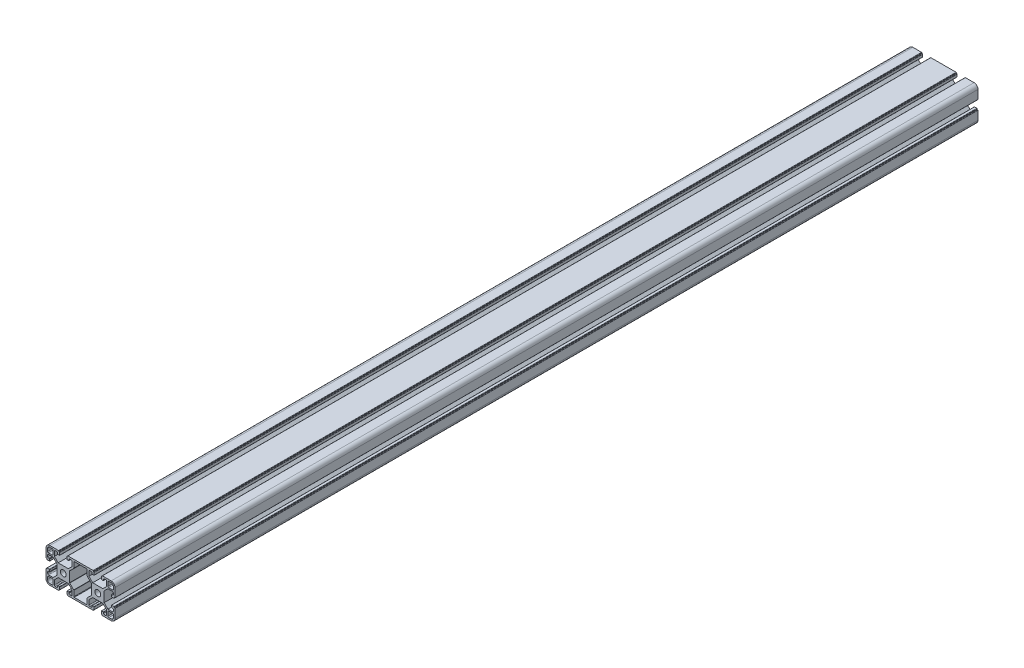
from build123d import *

# Parameters (mm, degrees)
MODEL_R             = 3.4
BOSS_EXTRUDE1_DEPTH = 1000


with BuildPart() as part:
    # Model → Boss-Extrude1 (new body)
    with BuildSketch(Plane.XY):
        with BuildLine():
            Line((3107.864182272, 1445.852361123), (3108.864182272, 1445.852361123))
            ThreePointArc((3108.864182272, 1445.852361123), (3109.076314306, 1445.940229088), (3109.164182272, 1446.152361123))
            Line((3109.164182272, 1446.152361123), (3109.164182272, 1448.052361123))
            ThreePointArc((3109.164182272, 1448.052361123), (3109.076314306, 1448.264493157), (3108.864182272, 1448.352361123))
            Line((3108.864182272, 1448.352361123), (3106.164182272, 1448.352361123))
            ThreePointArc((3106.164182272, 1448.352361123), (3105.952050238, 1448.264493157), (3105.864182272, 1448.052361123))
            Line((3105.864182272, 1448.052361123), (3105.864182272, 1447.552361123))
            ThreePointArc((3105.864182272, 1447.552361123), (3105.805603628, 1447.410939767), (3105.664182272, 1447.352361123))
            Line((3105.664182272, 1447.352361123), (3105.164182272, 1447.352361123))
            ThreePointArc((3105.164182272, 1447.352361123), (3104.952050238, 1447.264493157), (3104.864182272, 1447.052361123))
            Line((3104.864182272, 1447.052361123), (3104.864182272, 1436.952361123))
            ThreePointArc((3104.864182272, 1436.952361123), (3106.182201757, 1433.770380607), (3109.364182272, 1432.452361123))
            Line((3109.364182272, 1432.452361123), (3119.464182272, 1432.452361123))
            ThreePointArc((3119.464182272, 1432.452361123), (3119.676314306, 1432.540229088), (3119.764182272, 1432.752361123))
            Line((3119.764182272, 1432.752361123), (3119.764182272, 1433.252361123))
            ThreePointArc((3119.764182272, 1433.252361123), (3119.822760916, 1433.393782479), (3119.964182272, 1433.452361123))
            Line((3119.964182272, 1433.452361123), (3120.464182272, 1433.452361123))
            ThreePointArc((3120.464182272, 1433.452361123), (3120.676314306, 1433.540229088), (3120.764182272, 1433.752361123))
            Line((3120.764182272, 1433.752361123), (3120.764182272, 1436.452361123))
            ThreePointArc((3120.764182272, 1436.452361123), (3120.676314306, 1436.664493157), (3120.464182272, 1436.752361123))
            Line((3120.464182272, 1436.752361123), (3118.564182272, 1436.752361123))
            ThreePointArc((3118.564182272, 1436.752361123), (3118.352050238, 1436.664493157), (3118.264182272, 1436.452361123))
            Line((3118.264182272, 1436.452361123), (3118.264182272, 1435.452361123))
            ThreePointArc((3118.264182272, 1435.452361123), (3117.971289053, 1434.745254342), (3117.264182272, 1434.452361123))
            Line((3117.264182272, 1434.452361123), (3115.614182272, 1434.452361123))
            ThreePointArc((3115.614182272, 1434.452361123), (3114.907075491, 1434.745254342), (3114.614182272, 1435.452361123))
            Line((3114.614182272, 1435.452361123), (3114.614182272, 1440.717436882))
            Line((3114.614182272, 1440.717436882), (3118.949106512, 1445.052361123))
            Line((3118.949106512, 1445.052361123), (3130.779258031, 1445.052361123))
            Line((3130.779258031, 1445.052361123), (3135.114182272, 1440.717436882))
            Line((3135.114182272, 1440.717436882), (3135.114182272, 1435.452361123))
            ThreePointArc((3135.114182272, 1435.452361123), (3134.821289053, 1434.745254342), (3134.114182272, 1434.452361123))
            Line((3134.114182272, 1434.452361123), (3132.464182272, 1434.452361123))
            ThreePointArc((3132.464182272, 1434.452361123), (3131.757075491, 1434.745254342), (3131.464182272, 1435.452361123))
            Line((3131.464182272, 1435.452361123), (3131.464182272, 1436.452361123))
            ThreePointArc((3131.464182272, 1436.452361123), (3131.376314306, 1436.664493157), (3131.164182272, 1436.752361123))
            Line((3131.164182272, 1436.752361123), (3129.264182272, 1436.752361123))
            ThreePointArc((3129.264182272, 1436.752361123), (3129.052050238, 1436.664493157), (3128.964182272, 1436.452361123))
            Line((3128.964182272, 1436.452361123), (3128.964182272, 1433.752361123))
            ThreePointArc((3128.964182272, 1433.752361123), (3129.052050238, 1433.540229088), (3129.264182272, 1433.452361123))
            Line((3129.264182272, 1433.452361123), (3129.764182272, 1433.452361123))
            ThreePointArc((3129.764182272, 1433.452361123), (3129.905603628, 1433.393782479), (3129.964182272, 1433.252361123))
            Line((3129.964182272, 1433.252361123), (3129.964182272, 1432.752361123))
            ThreePointArc((3129.964182272, 1432.752361123), (3130.052050238, 1432.540229088), (3130.264182272, 1432.452361123))
            Line((3130.264182272, 1432.452361123), (3159.464182272, 1432.452361123))
            ThreePointArc((3159.464182272, 1432.452361123), (3159.676314306, 1432.540229088), (3159.764182272, 1432.752361123))
            Line((3159.764182272, 1432.752361123), (3159.764182272, 1433.252361123))
            ThreePointArc((3159.764182272, 1433.252361123), (3159.822760916, 1433.393782479), (3159.964182272, 1433.452361123))
            Line((3159.964182272, 1433.452361123), (3160.464182272, 1433.452361123))
            ThreePointArc((3160.464182272, 1433.452361123), (3160.676314306, 1433.540229088), (3160.764182272, 1433.752361123))
            Line((3160.764182272, 1433.752361123), (3160.764182272, 1436.452361123))
            ThreePointArc((3160.764182272, 1436.452361123), (3160.676314306, 1436.664493157), (3160.464182272, 1436.752361123))
            Line((3160.464182272, 1436.752361123), (3158.564182272, 1436.752361123))
            ThreePointArc((3158.564182272, 1436.752361123), (3158.352050238, 1436.664493157), (3158.264182272, 1436.452361123))
            Line((3158.264182272, 1436.452361123), (3158.264182272, 1435.452361123))
            ThreePointArc((3158.264182272, 1435.452361123), (3157.971289053, 1434.745254342), (3157.264182272, 1434.452361123))
            Line((3157.264182272, 1434.452361123), (3155.614182272, 1434.452361123))
            ThreePointArc((3155.614182272, 1434.452361123), (3154.907075491, 1434.745254342), (3154.614182272, 1435.452361123))
            Line((3154.614182272, 1435.452361123), (3154.614182272, 1440.717436882))
            Line((3154.614182272, 1440.717436882), (3158.949106512, 1445.052361123))
            Line((3158.949106512, 1445.052361123), (3170.779258031, 1445.052361123))
            Line((3170.779258031, 1445.052361123), (3175.114182272, 1440.717436882))
            Line((3175.114182272, 1440.717436882), (3175.114182272, 1435.452361123))
            ThreePointArc((3175.114182272, 1435.452361123), (3174.821289053, 1434.745254342), (3174.114182272, 1434.452361123))
            Line((3174.114182272, 1434.452361123), (3172.464182272, 1434.452361123))
            ThreePointArc((3172.464182272, 1434.452361123), (3171.757075491, 1434.745254342), (3171.464182272, 1435.452361123))
            Line((3171.464182272, 1435.452361123), (3171.464182272, 1436.452361123))
            ThreePointArc((3171.464182272, 1436.452361123), (3171.376314306, 1436.664493157), (3171.164182272, 1436.752361123))
            Line((3171.164182272, 1436.752361123), (3169.264182272, 1436.752361123))
            ThreePointArc((3169.264182272, 1436.752361123), (3169.052050238, 1436.664493157), (3168.964182272, 1436.452361123))
            Line((3168.964182272, 1436.452361123), (3168.964182272, 1433.752361123))
            ThreePointArc((3168.964182272, 1433.752361123), (3169.052050238, 1433.540229088), (3169.264182272, 1433.452361123))
            Line((3169.264182272, 1433.452361123), (3169.764182272, 1433.452361123))
            ThreePointArc((3169.764182272, 1433.452361123), (3169.905603628, 1433.393782479), (3169.964182272, 1433.252361123))
            Line((3169.964182272, 1433.252361123), (3169.964182272, 1432.752361123))
            ThreePointArc((3169.964182272, 1432.752361123), (3170.052050238, 1432.540229088), (3170.264182272, 1432.452361123))
            Line((3170.264182272, 1432.452361123), (3180.364182272, 1432.452361123))
            ThreePointArc((3180.364182272, 1432.452361123), (3183.546162787, 1433.770380607), (3184.864182272, 1436.952361123))
            Line((3184.864182272, 1436.952361123), (3184.864182272, 1447.052361123))
            ThreePointArc((3184.864182272, 1447.052361123), (3184.776314306, 1447.264493157), (3184.564182272, 1447.352361123))
            Line((3184.564182272, 1447.352361123), (3184.064182272, 1447.352361123))
            ThreePointArc((3184.064182272, 1447.352361123), (3183.922760916, 1447.410939767), (3183.864182272, 1447.552361123))
            Line((3183.864182272, 1447.552361123), (3183.864182272, 1448.052361123))
            ThreePointArc((3183.864182272, 1448.052361123), (3183.776314306, 1448.264493157), (3183.564182272, 1448.352361123))
            Line((3183.564182272, 1448.352361123), (3180.864182272, 1448.352361123))
            ThreePointArc((3180.864182272, 1448.352361123), (3180.652050238, 1448.264493157), (3180.564182272, 1448.052361123))
            Line((3180.564182272, 1448.052361123), (3180.564182272, 1446.152361123))
            ThreePointArc((3180.564182272, 1446.152361123), (3180.652050238, 1445.940229088), (3180.864182272, 1445.852361123))
            Line((3180.864182272, 1445.852361123), (3181.864182272, 1445.852361123))
            ThreePointArc((3181.864182272, 1445.852361123), (3182.571289053, 1445.559467904), (3182.864182272, 1444.852361123))
            Line((3182.864182272, 1444.852361123), (3182.864182272, 1443.202361123))
            ThreePointArc((3182.864182272, 1443.202361123), (3182.571289053, 1442.495254342), (3181.864182272, 1442.202361123))
            Line((3181.864182272, 1442.202361123), (3176.599106512, 1442.202361123))
            Line((3176.599106512, 1442.202361123), (3172.264182272, 1446.537285363))
            Line((3172.264182272, 1446.537285363), (3172.264182272, 1458.367436882))
            Line((3172.264182272, 1458.367436882), (3176.599106512, 1462.702361123))
            Line((3176.599106512, 1462.702361123), (3181.864182272, 1462.702361123))
            ThreePointArc((3181.864182272, 1462.702361123), (3182.571289053, 1462.409467904), (3182.864182272, 1461.702361123))
            Line((3182.864182272, 1461.702361123), (3182.864182272, 1460.052361123))
            ThreePointArc((3182.864182272, 1460.052361123), (3182.571289053, 1459.345254342), (3181.864182272, 1459.052361123))
            Line((3181.864182272, 1459.052361123), (3180.864182272, 1459.052361123))
            ThreePointArc((3180.864182272, 1459.052361123), (3180.652050238, 1458.964493157), (3180.564182272, 1458.752361123))
            Line((3180.564182272, 1458.752361123), (3180.564182272, 1456.852361123))
            ThreePointArc((3180.564182272, 1456.852361123), (3180.652050238, 1456.640229088), (3180.864182272, 1456.552361123))
            Line((3180.864182272, 1456.552361123), (3183.564182272, 1456.552361123))
            ThreePointArc((3183.564182272, 1456.552361123), (3183.776314306, 1456.640229088), (3183.864182272, 1456.852361123))
            Line((3183.864182272, 1456.852361123), (3183.864182272, 1457.352361123))
            ThreePointArc((3183.864182272, 1457.352361123), (3183.922760916, 1457.493782479), (3184.064182272, 1457.552361123))
            Line((3184.064182272, 1457.552361123), (3184.564182272, 1457.552361123))
            ThreePointArc((3184.564182272, 1457.552361123), (3184.776314306, 1457.640229088), (3184.864182272, 1457.852361123))
            Line((3184.864182272, 1457.852361123), (3184.864182272, 1467.952361123))
            ThreePointArc((3184.864182272, 1467.952361123), (3183.546162787, 1471.134341638), (3180.364182272, 1472.452361123))
            Line((3180.364182272, 1472.452361123), (3170.264182272, 1472.452361123))
            ThreePointArc((3170.264182272, 1472.452361123), (3170.052050238, 1472.364493157), (3169.964182272, 1472.152361123))
            Line((3169.964182272, 1472.152361123), (3169.964182272, 1471.652361123))
            ThreePointArc((3169.964182272, 1471.652361123), (3169.905603628, 1471.510939767), (3169.764182272, 1471.452361123))
            Line((3169.764182272, 1471.452361123), (3169.264182272, 1471.452361123))
            ThreePointArc((3169.264182272, 1471.452361123), (3169.052050238, 1471.364493157), (3168.964182272, 1471.152361123))
            Line((3168.964182272, 1471.152361123), (3168.964182272, 1468.452361123))
            ThreePointArc((3168.964182272, 1468.452361123), (3169.052050238, 1468.240229088), (3169.264182272, 1468.152361123))
            Line((3169.264182272, 1468.152361123), (3171.164182272, 1468.152361123))
            ThreePointArc((3171.164182272, 1468.152361123), (3171.376314306, 1468.240229088), (3171.464182272, 1468.452361123))
            Line((3171.464182272, 1468.452361123), (3171.464182272, 1469.452361123))
            ThreePointArc((3171.464182272, 1469.452361123), (3171.757075491, 1470.159467904), (3172.464182272, 1470.452361123))
            Line((3172.464182272, 1470.452361123), (3174.114182272, 1470.452361123))
            ThreePointArc((3174.114182272, 1470.452361123), (3174.821289053, 1470.159467904), (3175.114182272, 1469.452361123))
            Line((3175.114182272, 1469.452361123), (3175.114182272, 1464.187285363))
            Line((3175.114182272, 1464.187285363), (3170.779258031, 1459.852361123))
            Line((3170.779258031, 1459.852361123), (3158.949106512, 1459.852361123))
            Line((3158.949106512, 1459.852361123), (3154.614182272, 1464.187285363))
            Line((3154.614182272, 1464.187285363), (3154.614182272, 1469.452361123))
            ThreePointArc((3154.614182272, 1469.452361123), (3154.907075491, 1470.159467904), (3155.614182272, 1470.452361123))
            Line((3155.614182272, 1470.452361123), (3157.264182272, 1470.452361123))
            ThreePointArc((3157.264182272, 1470.452361123), (3157.971289053, 1470.159467904), (3158.264182272, 1469.452361123))
            Line((3158.264182272, 1469.452361123), (3158.264182272, 1468.452361123))
            ThreePointArc((3158.264182272, 1468.452361123), (3158.352050238, 1468.240229088), (3158.564182272, 1468.152361123))
            Line((3158.564182272, 1468.152361123), (3160.464182272, 1468.152361123))
            ThreePointArc((3160.464182272, 1468.152361123), (3160.676314306, 1468.240229088), (3160.764182272, 1468.452361123))
            Line((3160.764182272, 1468.452361123), (3160.764182272, 1471.152361123))
            ThreePointArc((3160.764182272, 1471.152361123), (3160.676314306, 1471.364493157), (3160.464182272, 1471.452361123))
            Line((3160.464182272, 1471.452361123), (3159.964182272, 1471.452361123))
            ThreePointArc((3159.964182272, 1471.452361123), (3159.822760916, 1471.510939767), (3159.764182272, 1471.652361123))
            Line((3159.764182272, 1471.652361123), (3159.764182272, 1472.152361123))
            ThreePointArc((3159.764182272, 1472.152361123), (3159.676314306, 1472.364493157), (3159.464182272, 1472.452361123))
            Line((3159.464182272, 1472.452361123), (3130.264182272, 1472.452361123))
            ThreePointArc((3130.264182272, 1472.452361123), (3130.052050238, 1472.364493157), (3129.964182272, 1472.152361123))
            Line((3129.964182272, 1472.152361123), (3129.964182272, 1471.652361123))
            ThreePointArc((3129.964182272, 1471.652361123), (3129.905603628, 1471.510939767), (3129.764182272, 1471.452361123))
            Line((3129.764182272, 1471.452361123), (3129.264182272, 1471.452361123))
            ThreePointArc((3129.264182272, 1471.452361123), (3129.052050238, 1471.364493157), (3128.964182272, 1471.152361123))
            Line((3128.964182272, 1471.152361123), (3128.964182272, 1468.452361123))
            ThreePointArc((3128.964182272, 1468.452361123), (3129.052050238, 1468.240229088), (3129.264182272, 1468.152361123))
            Line((3129.264182272, 1468.152361123), (3131.164182272, 1468.152361123))
            ThreePointArc((3131.164182272, 1468.152361123), (3131.376314306, 1468.240229088), (3131.464182272, 1468.452361123))
            Line((3131.464182272, 1468.452361123), (3131.464182272, 1469.452361123))
            ThreePointArc((3131.464182272, 1469.452361123), (3131.757075491, 1470.159467904), (3132.464182272, 1470.452361123))
            Line((3132.464182272, 1470.452361123), (3134.114182272, 1470.452361123))
            ThreePointArc((3134.114182272, 1470.452361123), (3134.821289053, 1470.159467904), (3135.114182272, 1469.452361123))
            Line((3135.114182272, 1469.452361123), (3135.114182272, 1464.187285363))
            Line((3135.114182272, 1464.187285363), (3130.779258031, 1459.852361123))
            Line((3130.779258031, 1459.852361123), (3118.949106512, 1459.852361123))
            Line((3118.949106512, 1459.852361123), (3114.614182272, 1464.187285363))
            Line((3114.614182272, 1464.187285363), (3114.614182272, 1469.452361123))
            ThreePointArc((3114.614182272, 1469.452361123), (3114.907075491, 1470.159467904), (3115.614182272, 1470.452361123))
            Line((3115.614182272, 1470.452361123), (3117.264182272, 1470.452361123))
            ThreePointArc((3117.264182272, 1470.452361123), (3117.971289053, 1470.159467904), (3118.264182272, 1469.452361123))
            Line((3118.264182272, 1469.452361123), (3118.264182272, 1468.452361123))
            ThreePointArc((3118.264182272, 1468.452361123), (3118.352050238, 1468.240229088), (3118.564182272, 1468.152361123))
            Line((3118.564182272, 1468.152361123), (3120.464182272, 1468.152361123))
            ThreePointArc((3120.464182272, 1468.152361123), (3120.676314306, 1468.240229088), (3120.764182272, 1468.452361123))
            Line((3120.764182272, 1468.452361123), (3120.764182272, 1471.152361123))
            ThreePointArc((3120.764182272, 1471.152361123), (3120.676314306, 1471.364493157), (3120.464182272, 1471.452361123))
            Line((3120.464182272, 1471.452361123), (3119.964182272, 1471.452361123))
            ThreePointArc((3119.964182272, 1471.452361123), (3119.822760916, 1471.510939767), (3119.764182272, 1471.652361123))
            Line((3119.764182272, 1471.652361123), (3119.764182272, 1472.152361123))
            ThreePointArc((3119.764182272, 1472.152361123), (3119.676314306, 1472.364493157), (3119.464182272, 1472.452361123))
            Line((3119.464182272, 1472.452361123), (3109.364182272, 1472.452361123))
            ThreePointArc((3109.364182272, 1472.452361123), (3106.182201757, 1471.134341638), (3104.864182272, 1467.952361123))
            Line((3104.864182272, 1467.952361123), (3104.864182272, 1457.852361123))
            ThreePointArc((3104.864182272, 1457.852361123), (3104.952050238, 1457.640229088), (3105.164182272, 1457.552361123))
            Line((3105.164182272, 1457.552361123), (3105.664182272, 1457.552361123))
            ThreePointArc((3105.664182272, 1457.552361123), (3105.805603628, 1457.493782479), (3105.864182272, 1457.352361123))
            Line((3105.864182272, 1457.352361123), (3105.864182272, 1456.852361123))
            ThreePointArc((3105.864182272, 1456.852361123), (3105.952050238, 1456.640229088), (3106.164182272, 1456.552361123))
            Line((3106.164182272, 1456.552361123), (3108.864182272, 1456.552361123))
            ThreePointArc((3108.864182272, 1456.552361123), (3109.076314306, 1456.640229088), (3109.164182272, 1456.852361123))
            Line((3109.164182272, 1456.852361123), (3109.164182272, 1458.752361123))
            ThreePointArc((3109.164182272, 1458.752361123), (3109.076314306, 1458.964493157), (3108.864182272, 1459.052361123))
            Line((3108.864182272, 1459.052361123), (3107.864182272, 1459.052361123))
            ThreePointArc((3107.864182272, 1459.052361123), (3107.157075491, 1459.345254342), (3106.864182272, 1460.052361123))
            Line((3106.864182272, 1460.052361123), (3106.864182272, 1461.702361123))
            ThreePointArc((3106.864182272, 1461.702361123), (3107.157075491, 1462.409467904), (3107.864182272, 1462.702361123))
            Line((3107.864182272, 1462.702361123), (3113.129258031, 1462.702361123))
            Line((3113.129258031, 1462.702361123), (3117.464182272, 1458.367436882))
            Line((3117.464182272, 1458.367436882), (3117.464182272, 1446.537285363))
            Line((3117.464182272, 1446.537285363), (3113.129258031, 1442.202361123))
            Line((3113.129258031, 1442.202361123), (3107.864182272, 1442.202361123))
            ThreePointArc((3107.864182272, 1442.202361123), (3107.157075491, 1442.495254342), (3106.864182272, 1443.202361123))
            Line((3106.864182272, 1443.202361123), (3106.864182272, 1444.852361123))
            ThreePointArc((3106.864182272, 1444.852361123), (3107.157075491, 1445.559467904), (3107.864182272, 1445.852361123))
        make_face()
        with Locations((3164.864182272, 1452.452361123)):
            Circle(MODEL_R, mode=Mode.SUBTRACT)
        with Locations((3124.864182272, 1452.452361123)):
            Circle(MODEL_R, mode=Mode.SUBTRACT)
        with BuildLine():
            Line((3180.364182272, 1470.652361123), (3177.614182272, 1470.652361123))
            ThreePointArc((3177.614182272, 1470.652361123), (3176.907075491, 1470.359467904), (3176.614182272, 1469.652361123))
            Line((3176.614182272, 1469.652361123), (3176.614182272, 1465.202361123))
            ThreePointArc((3176.614182272, 1465.202361123), (3176.907075491, 1464.495254342), (3177.614182272, 1464.202361123))
            Line((3177.614182272, 1464.202361123), (3182.064182272, 1464.202361123))
            ThreePointArc((3182.064182272, 1464.202361123), (3182.771289053, 1464.495254342), (3183.064182272, 1465.202361123))
            Line((3183.064182272, 1465.202361123), (3183.064182272, 1467.952361123))
            ThreePointArc((3183.064182272, 1467.952361123), (3182.273370581, 1469.861549432), (3180.364182272, 1470.652361123))
        make_face(mode=Mode.SUBTRACT)
        with BuildLine():
            Line((3183.064182272, 1436.952361123), (3183.064182272, 1439.702361123))
            ThreePointArc((3183.064182272, 1439.702361123), (3182.771289053, 1440.409467904), (3182.064182272, 1440.702361123))
            Line((3182.064182272, 1440.702361123), (3177.614182272, 1440.702361123))
            ThreePointArc((3177.614182272, 1440.702361123), (3176.907075491, 1440.409467904), (3176.614182272, 1439.702361123))
            Line((3176.614182272, 1439.702361123), (3176.614182272, 1435.252361123))
            ThreePointArc((3176.614182272, 1435.252361123), (3176.907075491, 1434.545254342), (3177.614182272, 1434.252361123))
            Line((3177.614182272, 1434.252361123), (3180.364182272, 1434.252361123))
            ThreePointArc((3180.364182272, 1434.252361123), (3182.273370581, 1435.043172814), (3183.064182272, 1436.952361123))
        make_face(mode=Mode.SUBTRACT)
        with BuildLine():
            Line((3106.664182272, 1465.202361123), (3106.664182272, 1467.952361123))
            ThreePointArc((3106.664182272, 1467.952361123), (3107.454993963, 1469.861549432), (3109.364182272, 1470.652361123))
            Line((3109.364182272, 1470.652361123), (3112.114182272, 1470.652361123))
            ThreePointArc((3112.114182272, 1470.652361123), (3112.821289053, 1470.359467904), (3113.114182272, 1469.652361123))
            Line((3113.114182272, 1469.652361123), (3113.114182272, 1465.202361123))
            ThreePointArc((3113.114182272, 1465.202361123), (3112.821289053, 1464.495254342), (3112.114182272, 1464.202361123))
            Line((3112.114182272, 1464.202361123), (3107.664182272, 1464.202361123))
            ThreePointArc((3107.664182272, 1464.202361123), (3106.957075491, 1464.495254342), (3106.664182272, 1465.202361123))
        make_face(mode=Mode.SUBTRACT)
        with BuildLine():
            Line((3152.614182272, 1434.952361123), (3152.614182272, 1441.338757226))
            ThreePointArc((3152.614182272, 1441.338757226), (3152.652242506, 1441.530098942), (3152.760628881, 1441.692310616))
            Line((3152.760628881, 1441.692310616), (3157.317735663, 1446.249417398))
            ThreePointArc((3157.317735663, 1446.249417398), (3157.426122038, 1446.411629072), (3157.464182272, 1446.602970788))
            Line((3157.464182272, 1446.602970788), (3157.464182272, 1458.301751457))
            ThreePointArc((3157.464182272, 1458.301751457), (3157.426122038, 1458.493093174), (3157.317735663, 1458.655304848))
            Line((3157.317735663, 1458.655304848), (3152.760628881, 1463.212411629))
            ThreePointArc((3152.760628881, 1463.212411629), (3152.652242506, 1463.374623304), (3152.614182272, 1463.56596502))
            Line((3152.614182272, 1463.56596502), (3152.614182272, 1469.952361123))
            ThreePointArc((3152.614182272, 1469.952361123), (3152.467735663, 1470.305914513), (3152.114182272, 1470.452361123))
            Line((3152.114182272, 1470.452361123), (3137.614182272, 1470.452361123))
            ThreePointArc((3137.614182272, 1470.452361123), (3137.260628881, 1470.305914513), (3137.114182272, 1469.952361123))
            Line((3137.114182272, 1469.952361123), (3137.114182272, 1463.56596502))
            ThreePointArc((3137.114182272, 1463.56596502), (3137.076122038, 1463.374623304), (3136.967735663, 1463.212411629))
            Line((3136.967735663, 1463.212411629), (3132.410628881, 1458.655304848))
            ThreePointArc((3132.410628881, 1458.655304848), (3132.302242506, 1458.493093174), (3132.264182272, 1458.301751457))
            Line((3132.264182272, 1458.301751457), (3132.264182272, 1446.602970788))
            ThreePointArc((3132.264182272, 1446.602970788), (3132.302242506, 1446.411629072), (3132.410628881, 1446.249417398))
            Line((3132.410628881, 1446.249417398), (3136.967735663, 1441.692310616))
            ThreePointArc((3136.967735663, 1441.692310616), (3137.076122038, 1441.530098942), (3137.114182272, 1441.338757226))
            Line((3137.114182272, 1441.338757226), (3137.114182272, 1434.952361123))
            ThreePointArc((3137.114182272, 1434.952361123), (3137.260628881, 1434.598807732), (3137.614182272, 1434.452361123))
            Line((3137.614182272, 1434.452361123), (3152.114182272, 1434.452361123))
            ThreePointArc((3152.114182272, 1434.452361123), (3152.467735663, 1434.598807732), (3152.614182272, 1434.952361123))
        make_face(mode=Mode.SUBTRACT)
        with BuildLine():
            Line((3112.114182272, 1434.252361123), (3109.364182272, 1434.252361123))
            ThreePointArc((3109.364182272, 1434.252361123), (3107.454993963, 1435.043172814), (3106.664182272, 1436.952361123))
            Line((3106.664182272, 1436.952361123), (3106.664182272, 1439.702361123))
            ThreePointArc((3106.664182272, 1439.702361123), (3106.957075491, 1440.409467904), (3107.664182272, 1440.702361123))
            Line((3107.664182272, 1440.702361123), (3112.114182272, 1440.702361123))
            ThreePointArc((3112.114182272, 1440.702361123), (3112.821289053, 1440.409467904), (3113.114182272, 1439.702361123))
            Line((3113.114182272, 1439.702361123), (3113.114182272, 1435.252361123))
            ThreePointArc((3113.114182272, 1435.252361123), (3112.821289053, 1434.545254342), (3112.114182272, 1434.252361123))
        make_face(mode=Mode.SUBTRACT)
    extrude(amount=BOSS_EXTRUDE1_DEPTH)


solid = part.part
